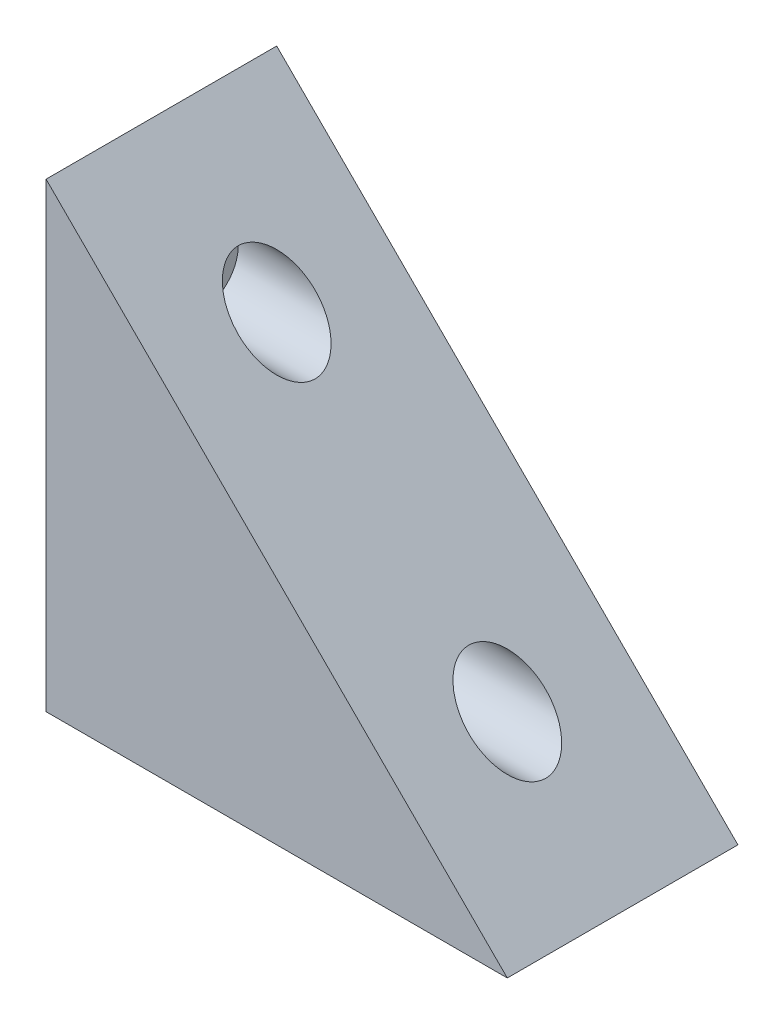
from build123d import *

# Parameters (mm, degrees)
EXTRUDE_1_DEPTH     = 30
SKETCH_2_R          = 3
CUT_EXTRUDE_1_DEPTH = 60
SKETCH_3_R          = 5
CUT_EXTRUDE_2_DEPTH = 60


with BuildPart() as part:
    # 스케치1 → 보스-돌출1 (new body)
    with BuildSketch(Plane.XY):
        Polygon((0, 0), (0, 60), (60, 0), align=None)
    extrude(amount=EXTRUDE_1_DEPTH)

    # 스케치2 → 컷-돌출1 (cut)
    with BuildSketch(Plane.ZY):
        with Locations((15, 15)):
            Circle(SKETCH_2_R)
        with Locations((15, 45)):
            Circle(SKETCH_2_R)
    extrude(amount=-CUT_EXTRUDE_1_DEPTH, mode=Mode.SUBTRACT)

    # 스케치3 → 컷-돌출2 (cut)
    with BuildSketch(Plane.ZY.offset(-5)):
        with Locations((15, 15)):
            Circle(SKETCH_3_R)
        with Locations((15, 45)):
            Circle(SKETCH_3_R)
    extrude(amount=-CUT_EXTRUDE_2_DEPTH, mode=Mode.SUBTRACT)


solid = part.part
